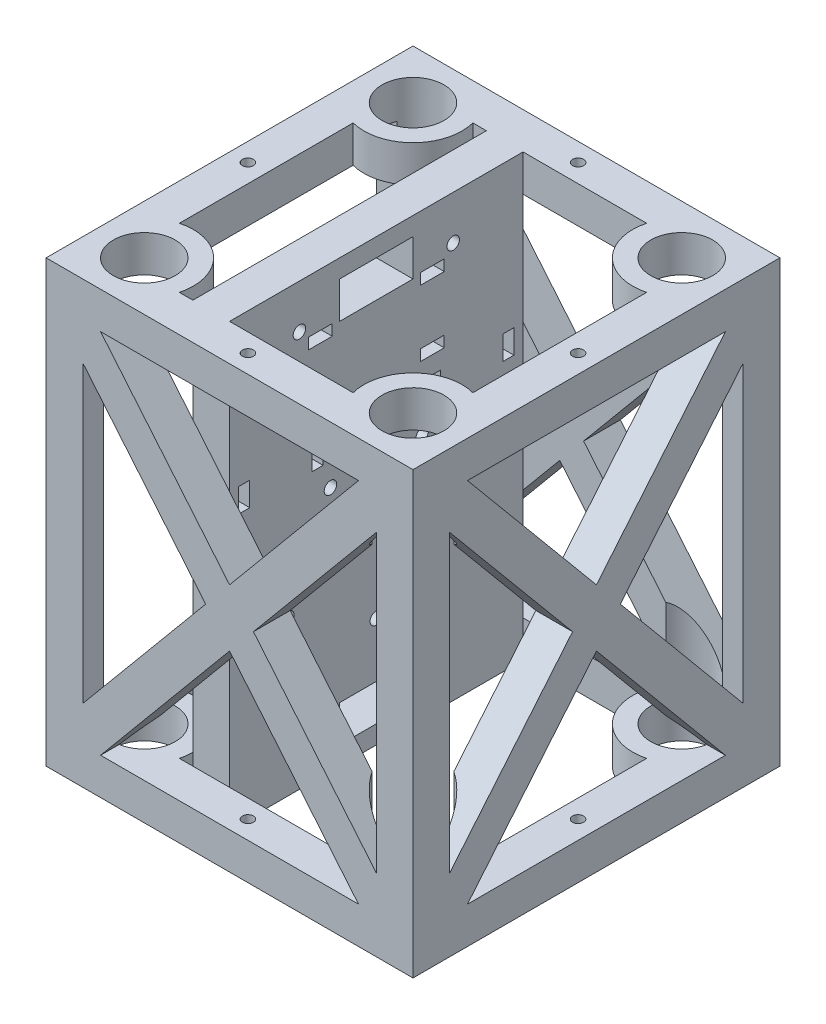
from build123d import *

# Parameters (mm, degrees)
SKETCH3_W               = 100
SKETCH3_H               = 100
SKETCH3_W_2             = 80
SKETCH3_H_2             = 80
BOSS_EXTRUDE1_DEPTH     = 120
CUT_EXTRUDE6_DEPTH      = 186.47236991
CIRPATTERN1_COUNT       = 2
CIRPATTERN1_ANGLE       = 90
SKETCH19_R              = 13.375
SKETCH19_R_2            = 8.4375
BOSS_EXTRUDE3_DEPTH     = 10
BOSS_EXTRUDE4_START     = -110
SKETCH19_2_R            = 13.375
SKETCH19_2_R_2          = 8.4375
BOSS_EXTRUDE4_DEPTH     = 10
CUT_EXTRUDE4_DEPTH      = 186.47236991
CUT_EXTRUDE4_DEPTH_BACK = 186.47236991
SKETCH8_R               = 8.4375
CUT_EXTRUDE11_START     = 120
SKETCH21_R              = 1.5
CUT_EXTRUDE11_DEPTH     = 10
CUT_EXTRUDE12_START     = 10
SKETCH21_2_R            = 1.5
CUT_EXTRUDE12_DEPTH     = 10
ELECTRONICSPLATE_START  = 120
SKETCH9_W               = 10
SKETCH9_H               = 80
ELECTRONICSPLATE_DEPTH  = 120
CUT_EXTRUDE10_REACH     = 187.472
SKETCH18_W              = 80
SKETCH18_H              = 100
BEAGLEBONEHOLES_START   = 40
SKETCH12_R              = 1.7
BEAGLEBONEHOLES_DEPTH   = 10
RFDHOLES_START          = 40
SKETCH13_R              = 1.7
RFDHOLES_DEPTH          = 10
ANTENNACAVITY_START     = 30
SKETCH35_W              = 12
SKETCH35_H              = 43
ANTENNACAVITY_DEPTH     = 5
ZIPTIEHOLES_START       = 30
SKETCH36_W              = 3
SKETCH36_H              = 6.5
SKETCH36_W_2            = 6.5
SKETCH36_H_2            = 3
ZIPTIEHOLES_DEPTH       = 10
CUT_EXTRUDE16_START     = 30
SKETCH36_3_W            = 17
SKETCH36_3_H            = 6.5
SKETCH36_3_W_2          = 6.5
SKETCH36_3_H_2          = 15
CUT_EXTRUDE16_DEPTH     = 5
WIREHOLES_START         = 40
SKETCH37_W              = 10
SKETCH37_H              = 10
WIREHOLES_DEPTH         = 10


with BuildPart() as part:
    # Sketch3 → Boss-Extrude1 (new body)
    with BuildSketch(Plane(origin=(0, 0, 0), x_dir=(1, 0, 0), z_dir=(0, 1, 0))):
        with Locations((50, 50)):
            Rectangle(SKETCH3_W, SKETCH3_H)
        with Locations((50, 50)):
            Rectangle(SKETCH3_W_2, SKETCH3_H_2, mode=Mode.SUBTRACT)
    extrude(amount=BOSS_EXTRUDE1_DEPTH)

    # Sketch6 → Cut-Extrude6 (cut, symmetric)
    with BuildSketch(Plane.XY):
        Polygon((14.84187473, 110), (50, 67.810249676), (85.15812527, 110), align=None)
        Polygon((56.508541397, 60), (90, 100.189750324), (90, 19.810249676), align=None)
        Polygon((14.84187473, 10), (50, 52.189750324), (85.15812527, 10), align=None)
        Polygon((10, 19.810249676), (43.491458603, 60), (10, 100.189750324), align=None)
    cut_extrude6 = extrude(amount=CUT_EXTRUDE6_DEPTH, both=True, mode=Mode.SUBTRACT)

    # CirPattern1: Cut-Extrude6 ×2 about axis
    cirpattern1_axis = Axis((50, 0, -50), (0, 1, 0))
    for i in range(1, CIRPATTERN1_COUNT):
        add(cut_extrude6.rotate(cirpattern1_axis, i * CIRPATTERN1_ANGLE / (CIRPATTERN1_COUNT - 1)), mode=Mode.SUBTRACT)

    # Sketch19 → Boss-Extrude3 (add)
    # profile 1 of 4: a face of its own
    with BuildSketch(Plane(origin=(0, 120, 0), x_dir=(1, 0, 0), z_dir=(0, 1, 0))):
        with Locations((13.375, 86.625)):
            Circle(SKETCH19_R)
        with Locations((13.375, 86.625)):
            Circle(SKETCH19_R_2, mode=Mode.SUBTRACT)
    # profile 2 of 4: a face of its own
    with BuildSketch(Plane(origin=(0, 120, 0), x_dir=(1, 0, 0), z_dir=(0, 1, 0))):
        with Locations((86.625, 86.625)):
            Circle(SKETCH19_R)
        with Locations((86.625, 86.625)):
            Circle(SKETCH19_R_2, mode=Mode.SUBTRACT)
    # profile 3 of 4: a face of its own
    with BuildSketch(Plane(origin=(0, 120, 0), x_dir=(1, 0, 0), z_dir=(0, 1, 0))):
        with Locations((86.625, 13.375)):
            Circle(SKETCH19_R)
        with Locations((86.625, 13.375)):
            Circle(SKETCH19_R_2, mode=Mode.SUBTRACT)
    # profile 4 of 4: a face of its own
    with BuildSketch(Plane(origin=(0, 120, 0), x_dir=(1, 0, 0), z_dir=(0, 1, 0))):
        with Locations((13.375, 13.375)):
            Circle(SKETCH19_R)
        with Locations((13.375, 13.375)):
            Circle(SKETCH19_R_2, mode=Mode.SUBTRACT)
    extrude(amount=-BOSS_EXTRUDE3_DEPTH)

    # Sketch19<2> → Boss-Extrude4 (add)
    # profile 1 of 4: a face of its own
    with BuildSketch(Plane(origin=(0, 120, 0), x_dir=(1, 0, 0), z_dir=(0, 1, 0)).offset(BOSS_EXTRUDE4_START)):
        with Locations((13.375, 86.625)):
            Circle(SKETCH19_2_R)
    # profile 2 of 4: a face of its own
    with BuildSketch(Plane(origin=(0, 120, 0), x_dir=(1, 0, 0), z_dir=(0, 1, 0)).offset(BOSS_EXTRUDE4_START)):
        with Locations((86.625, 86.625)):
            Circle(SKETCH19_2_R)
        with Locations((86.625, 86.625)):
            Circle(SKETCH19_2_R_2, mode=Mode.SUBTRACT)
    # profile 3 of 4: a face of its own
    with BuildSketch(Plane(origin=(0, 120, 0), x_dir=(1, 0, 0), z_dir=(0, 1, 0)).offset(BOSS_EXTRUDE4_START)):
        with Locations((86.625, 13.375)):
            Circle(SKETCH19_2_R)
        with Locations((86.625, 13.375)):
            Circle(SKETCH19_2_R_2, mode=Mode.SUBTRACT)
    # profile 4 of 4: a face of its own
    with BuildSketch(Plane(origin=(0, 120, 0), x_dir=(1, 0, 0), z_dir=(0, 1, 0)).offset(BOSS_EXTRUDE4_START)):
        with Locations((13.375, 13.375)):
            Circle(SKETCH19_2_R)
        with Locations((13.375, 13.375)):
            Circle(SKETCH19_2_R_2, mode=Mode.SUBTRACT)
    extrude(amount=-BOSS_EXTRUDE4_DEPTH)

    # Sketch8 → Cut-Extrude4 (cut, two sides: drawn at the far end of the back side and taken through both)
    with BuildSketch(Plane(origin=(0, 0, 0), x_dir=(1, 0, 0), z_dir=(0, 1, 0)).offset(-CUT_EXTRUDE4_DEPTH_BACK)):
        with Locations(Location((13.375, 13.375, 0), (0, 0, 90))):
            Circle(SKETCH8_R)
        with Locations(Location((13.375, 86.625, 0), (0, 0, 90))):
            Circle(SKETCH8_R)
        with Locations(Location((86.625, 86.625, 0), (0, 0, 90))):
            Circle(SKETCH8_R)
        with Locations(Location((86.625, 13.375, 0), (0, 0, 90))):
            Circle(SKETCH8_R)
    extrude(amount=CUT_EXTRUDE4_DEPTH + CUT_EXTRUDE4_DEPTH_BACK, mode=Mode.SUBTRACT)

    # Sketch21 → Cut-Extrude11 (cut)
    with BuildSketch(Plane(origin=(0, 0, 0), x_dir=(1, 0, 0), z_dir=(0, 1, 0)).offset(CUT_EXTRUDE11_START)):
        with Locations(Location((5, 50, 0), (0, 0, 270))):
            Circle(SKETCH21_R)
        with Locations(Location((50, 95, 0), (0, 0, 270))):
            Circle(SKETCH21_R)
        with Locations(Location((95, 50, 0), (0, 0, 270))):
            Circle(SKETCH21_R)
        with Locations(Location((50, 5, 0), (0, 0, 270))):
            Circle(SKETCH21_R)
    extrude(amount=-CUT_EXTRUDE11_DEPTH, mode=Mode.SUBTRACT)

    # Sketch21<2> → Cut-Extrude12 (cut)
    with BuildSketch(Plane(origin=(0, 0, 0), x_dir=(1, 0, 0), z_dir=(0, 1, 0)).offset(CUT_EXTRUDE12_START)):
        with Locations(Location((5, 50, 0), (0, 0, 270))):
            Circle(SKETCH21_2_R)
        with Locations(Location((50, 95, 0), (0, 0, 270))):
            Circle(SKETCH21_2_R)
        with Locations(Location((95, 50, 0), (0, 0, 270))):
            Circle(SKETCH21_2_R)
        with Locations(Location((50, 5, 0), (0, 0, 270))):
            Circle(SKETCH21_2_R)
    extrude(amount=-CUT_EXTRUDE12_DEPTH, mode=Mode.SUBTRACT)

    # Sketch9 → ElectronicsPlate (add)
    with BuildSketch(Plane(origin=(0, 0, 0), x_dir=(1, 0, 0), z_dir=(0, 1, 0)).offset(ELECTRONICSPLATE_START)):
        with Locations((35, 50)):
            Rectangle(SKETCH9_W, SKETCH9_H)
    extrude(amount=-ELECTRONICSPLATE_DEPTH)

    # Sketch18 → Cut-Extrude10 (cut, up to next)
    with BuildSketch(Plane.ZY, mode=Mode.PRIVATE) as cut_extrude10_sk1:
        with Locations((-50, 60)):
            Rectangle(SKETCH18_W, SKETCH18_H)
    cut_extrude10_tool1 = extrude(cut_extrude10_sk1.sketch, amount=-CUT_EXTRUDE10_REACH, mode=Mode.PRIVATE) & part.part
    add(cut_extrude10_tool1.solids().sort_by_distance((0, 60, -50))[0], mode=Mode.SUBTRACT)

    # Sketch12 → BeagleboneHoles (cut)
    with BuildSketch(Plane(origin=(0, 0, 0), x_dir=(0, 0, -1), z_dir=(1, 0, 0)).offset(BEAGLEBONEHOLES_START)):
        with Locations((25.87, 41.96)):
            Circle(SKETCH12_R)
        with Locations((74.13, 41.96)):
            Circle(SKETCH12_R)
        with Locations((29.045, 108)):
            Circle(SKETCH12_R)
        with Locations((70.955, 108)):
            Circle(SKETCH12_R)
    extrude(amount=-BEAGLEBONEHOLES_DEPTH, mode=Mode.SUBTRACT)

    # Sketch13 → RFDHoles (cut)
    with BuildSketch(Plane(origin=(0, 0, 0), x_dir=(0, 0, -1), z_dir=(1, 0, 0)).offset(RFDHOLES_START)):
        with Locations((50, 30)):
            Circle(SKETCH13_R)
        with Locations((37.5, 67)):
            Circle(SKETCH13_R)
        with Locations((62.5, 67)):
            Circle(SKETCH13_R)
    extrude(amount=-RFDHOLES_DEPTH, mode=Mode.SUBTRACT)

    # Sketch35 → AntennaCavity (cut)
    with BuildSketch(Plane(origin=(0, 0, 0), x_dir=(0, 0, -1), z_dir=(1, 0, 0)).offset(ANTENNACAVITY_START)):
        with Locations((24, 68.5)):
            Rectangle(SKETCH35_W, SKETCH35_H)
        Polygon((18, 90), (30, 90), (50, 90), (50, 100), (18, 100), align=None)
        Polygon((50, 100), (50, 90), (70, 90), (82, 90), (82, 100), align=None)
        with Locations((76, 68.5)):
            Rectangle(SKETCH35_W, SKETCH35_H)
    extrude(amount=ANTENNACAVITY_DEPTH, mode=Mode.SUBTRACT)

    # Sketch36 → ZiptieHoles (cut)
    with BuildSketch(Plane(origin=(0, 0, 0), x_dir=(0, 0, -1), z_dir=(1, 0, 0)).offset(ZIPTIEHOLES_START)):
        with Locations((34, 53.701837694)):
            Rectangle(SKETCH36_W, SKETCH36_H)
        with Locations((14, 53.701837694)):
            Rectangle(SKETCH36_W, SKETCH36_H)
        with Locations((34, 76.513807116)):
            Rectangle(SKETCH36_W, SKETCH36_H)
        with Locations((14, 76.513807116)):
            Rectangle(SKETCH36_W, SKETCH36_H)
        with Locations((34.734232458, 86)):
            Rectangle(SKETCH36_W_2, SKETCH36_H_2)
        with Locations((34.734232458, 104)):
            Rectangle(SKETCH36_W_2, SKETCH36_H_2)
        with Locations((65.265767542, 104)):
            Rectangle(SKETCH36_W_2, SKETCH36_H_2)
        with Locations((65.265767542, 86)):
            Rectangle(SKETCH36_W_2, SKETCH36_H_2)
        with Locations((66, 76.513807116)):
            Rectangle(SKETCH36_W, SKETCH36_H)
        with Locations((86, 76.513807116)):
            Rectangle(SKETCH36_W, SKETCH36_H)
        with Locations((86, 53.701837694)):
            Rectangle(SKETCH36_W, SKETCH36_H)
        with Locations((66, 53.701837694)):
            Rectangle(SKETCH36_W, SKETCH36_H)
    extrude(amount=ZIPTIEHOLES_DEPTH, mode=Mode.SUBTRACT)

    # Sketch36<3> → Cut-Extrude16 (cut)
    with BuildSketch(Plane(origin=(0, 0, 0), x_dir=(0, 0, -1), z_dir=(1, 0, 0)).offset(CUT_EXTRUDE16_START)):
        with Locations((24, 76.513807116)):
            Rectangle(SKETCH36_3_W, SKETCH36_3_H)
        with Locations((34.734232458, 95)):
            Rectangle(SKETCH36_3_W_2, SKETCH36_3_H_2)
        with Locations((65.265767542, 95)):
            Rectangle(SKETCH36_3_W_2, SKETCH36_3_H_2)
        with Locations((76, 76.513807116)):
            Rectangle(SKETCH36_3_W, SKETCH36_3_H)
        with Locations((76, 53.701837694)):
            Rectangle(SKETCH36_3_W, SKETCH36_3_H)
        with Locations((24, 53.701837694)):
            Rectangle(SKETCH36_3_W, SKETCH36_3_H)
    extrude(amount=CUT_EXTRUDE16_DEPTH, mode=Mode.SUBTRACT)

    # Sketch37 → WireHoles (cut)
    with BuildSketch(Plane(origin=(0, 0, 0), x_dir=(0, 0, -1), z_dir=(1, 0, 0)).offset(WIREHOLES_START)):
        with Locations((45, 10)):
            Rectangle(SKETCH37_W, SKETCH37_H)
        with Locations((55, 10)):
            Rectangle(SKETCH37_W, SKETCH37_H)
        with Locations((55, 110)):
            Rectangle(SKETCH37_W, SKETCH37_H)
        with Locations((45, 110)):
            Rectangle(SKETCH37_W, SKETCH37_H)
    extrude(amount=-WIREHOLES_DEPTH, mode=Mode.SUBTRACT)


solid = part.part
